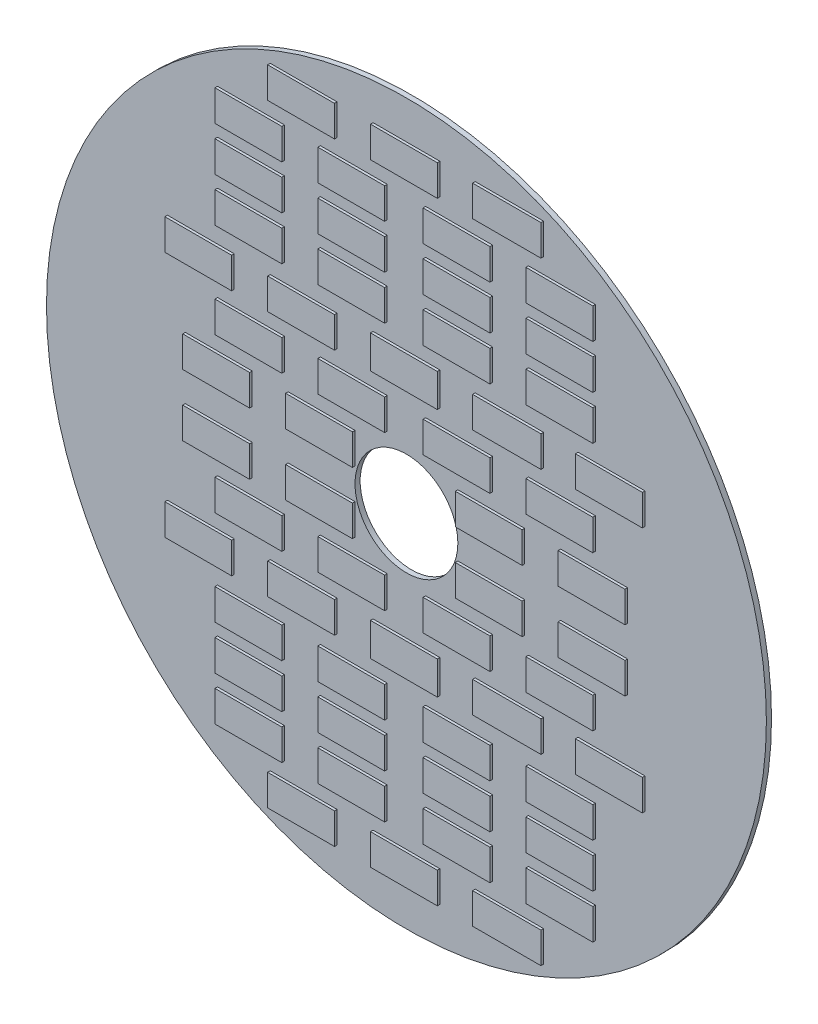
from build123d import *

# Parameters (mm, degrees)
SKETCH_2_R      = 700
SKETCH_2_R_2    = 100
EXTRUDE_1_DEPTH = 10
SKETCH_1_W      = 130
SKETCH_1_H      = 60
SKETCH_1_W_2    = 132.888940811
SKETCH_1_H_2    = 64.237478293
EXTRUDE_2_DEPTH = 15


with BuildPart() as part:
    # 草图2 → 凸台-拉伸1 (new body)
    with BuildSketch(Plane.XY):
        Circle(SKETCH_2_R)
        Circle(SKETCH_2_R_2, mode=Mode.SUBTRACT)
    extrude(amount=EXTRUDE_1_DEPTH)

    # 草图1 → 凸台-拉伸2 (add)
    with BuildSketch(Plane.XY):
        with Locations((165, 60)):
            Rectangle(SKETCH_1_W, SKETCH_1_H)
        with Locations((365, 60)):
            Rectangle(SKETCH_1_W, SKETCH_1_H)
        with Locations((102.356618967, 150)):
            Rectangle(SKETCH_1_W, SKETCH_1_H)
        with Locations((302.356618967, 150)):
            Rectangle(SKETCH_1_W, SKETCH_1_H)
        with Locations((102.356618967, 334.237478293)):
            Rectangle(SKETCH_1_W, SKETCH_1_H)
        with Locations((302.356618967, 334.237478293)):
            Rectangle(SKETCH_1_W, SKETCH_1_H)
        with Locations((200.169686036, 240)):
            Rectangle(SKETCH_1_W_2, SKETCH_1_H)
        with Locations((398.72521563, 240)):
            Rectangle(SKETCH_1_W, SKETCH_1_H)
        with Locations((0, 242.118739147)):
            Rectangle(SKETCH_1_W, SKETCH_1_H_2)
        with Locations((-199.830313965, 240)):
            Rectangle(SKETCH_1_W, SKETCH_1_H)
        with Locations((-399.830313965, 240)):
            Rectangle(SKETCH_1_W, SKETCH_1_H)
        with Locations((102.356618967, 420)):
            Rectangle(SKETCH_1_W, SKETCH_1_H)
        with Locations((302.356618967, 420)):
            Rectangle(SKETCH_1_W, SKETCH_1_H)
        with Locations((102.356618967, 505.762521707)):
            Rectangle(SKETCH_1_W, SKETCH_1_H)
        with Locations((302.356618967, 505.762521707)):
            Rectangle(SKETCH_1_W, SKETCH_1_H)
        with Locations((200.169686036, 595.762521707)):
            Rectangle(SKETCH_1_W_2, SKETCH_1_H)
        with Locations((0, 595.762521707)):
            Rectangle(SKETCH_1_W, SKETCH_1_H)
        with Locations((-199.830313965, 595.762521707)):
            Rectangle(SKETCH_1_W, SKETCH_1_H)
        with Locations((-365, 60)):
            Rectangle(SKETCH_1_W, SKETCH_1_H)
        with Locations((-165, 60)):
            Rectangle(SKETCH_1_W, SKETCH_1_H)
        with Locations((-102.356618967, 150)):
            Rectangle(SKETCH_1_W, SKETCH_1_H)
        with Locations((-302.356618967, 150)):
            Rectangle(SKETCH_1_W, SKETCH_1_H)
        with Locations((-102.356618967, 505.762521707)):
            Rectangle(SKETCH_1_W, SKETCH_1_H)
        with Locations((-302.356618967, 505.762521707)):
            Rectangle(SKETCH_1_W, SKETCH_1_H)
        with Locations((-102.356618967, 420)):
            Rectangle(SKETCH_1_W, SKETCH_1_H)
        with Locations((-302.356618967, 420)):
            Rectangle(SKETCH_1_W, SKETCH_1_H)
        with Locations((-102.356618967, 334.237478293)):
            Rectangle(SKETCH_1_W, SKETCH_1_H)
        with Locations((-302.356618967, 334.237478293)):
            Rectangle(SKETCH_1_W, SKETCH_1_H)
        with Locations((-102.356618967, -334.237478293)):
            Rectangle(SKETCH_1_W, SKETCH_1_H)
        with Locations((-302.356618967, -334.237478293)):
            Rectangle(SKETCH_1_W, SKETCH_1_H)
        with Locations((-102.356618967, -420)):
            Rectangle(SKETCH_1_W, SKETCH_1_H)
        with Locations((-302.356618967, -420)):
            Rectangle(SKETCH_1_W, SKETCH_1_H)
        with Locations((-102.356618967, -505.762521707)):
            Rectangle(SKETCH_1_W, SKETCH_1_H)
        with Locations((-302.356618967, -505.762521707)):
            Rectangle(SKETCH_1_W, SKETCH_1_H)
        with Locations((-302.356618967, -150)):
            Rectangle(SKETCH_1_W, SKETCH_1_H)
        with Locations((-102.356618967, -150)):
            Rectangle(SKETCH_1_W, SKETCH_1_H)
        with Locations((-165, -60)):
            Rectangle(SKETCH_1_W, SKETCH_1_H)
        with Locations((-365, -60)):
            Rectangle(SKETCH_1_W, SKETCH_1_H)
        with Locations((-199.830313965, -595.762521707)):
            Rectangle(SKETCH_1_W, SKETCH_1_H)
        with Locations((200.169686036, -595.762521707)):
            Rectangle(SKETCH_1_W_2, SKETCH_1_H)
        with Locations((0, -595.762521707)):
            Rectangle(SKETCH_1_W, SKETCH_1_H)
        with Locations((102.356618967, -505.762521707)):
            Rectangle(SKETCH_1_W, SKETCH_1_H)
        with Locations((302.356618967, -505.762521707)):
            Rectangle(SKETCH_1_W, SKETCH_1_H)
        with Locations((102.356618967, -420)):
            Rectangle(SKETCH_1_W, SKETCH_1_H)
        with Locations((302.356618967, -420)):
            Rectangle(SKETCH_1_W, SKETCH_1_H)
        with Locations((102.356618967, -334.237478293)):
            Rectangle(SKETCH_1_W, SKETCH_1_H)
        with Locations((302.356618967, -334.237478293)):
            Rectangle(SKETCH_1_W, SKETCH_1_H)
        with Locations((-399.830313965, -240)):
            Rectangle(SKETCH_1_W, SKETCH_1_H)
        with Locations((-199.830313965, -240)):
            Rectangle(SKETCH_1_W, SKETCH_1_H)
        with Locations((0, -242.118739147)):
            Rectangle(SKETCH_1_W, SKETCH_1_H_2)
        with Locations((200.169686036, -240)):
            Rectangle(SKETCH_1_W_2, SKETCH_1_H)
        with Locations((398.72521563, -240)):
            Rectangle(SKETCH_1_W, SKETCH_1_H)
        with Locations((102.356618967, -150)):
            Rectangle(SKETCH_1_W, SKETCH_1_H)
        with Locations((302.356618967, -150)):
            Rectangle(SKETCH_1_W, SKETCH_1_H)
        with Locations((365, -60)):
            Rectangle(SKETCH_1_W, SKETCH_1_H)
        with Locations((165, -60)):
            Rectangle(SKETCH_1_W, SKETCH_1_H)
    extrude(amount=EXTRUDE_2_DEPTH)


solid = part.part
